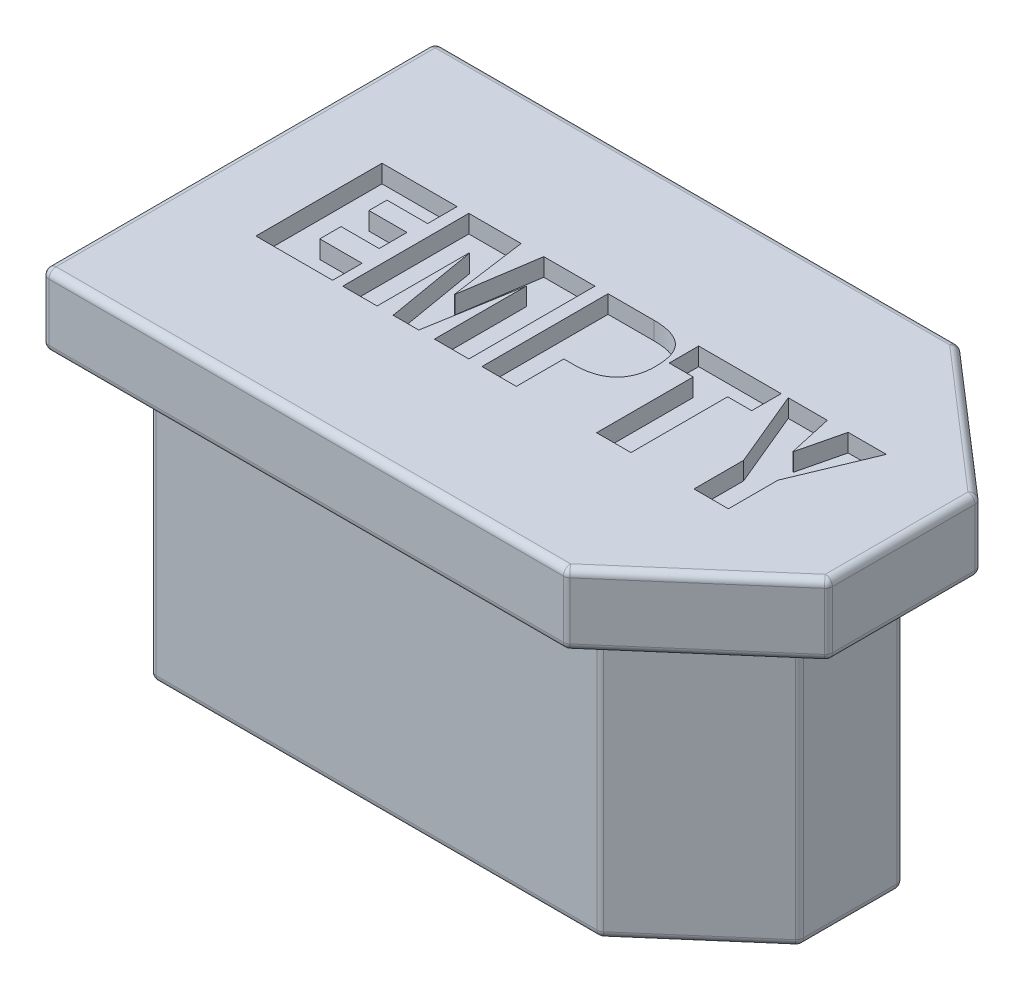
from build123d import *

# Parameters (mm, degrees)
BOSS_EXTRUDE1_DEPTH = 4
SHELL1_T            = -0.7
BOSS_EXTRUDE2_DEPTH = 2
BOSS_EXTRUDE4_REACH = 16.722
SKETCH4_W           = 2
SKETCH4_H           = 1.2
SKETCH5_W           = 1.1
SKETCH5_H           = 4
CUT_EXTRUDE1_DEPTH  = 1
FILLET1_R           = 0.2
CUT_EXTRUDE2_DEPTH  = 0.5


with BuildPart() as part:
    # Sketch1 → Boss-Extrude1 (new, symmetric)
    with BuildSketch(Plane(origin=(0, 0, 0), x_dir=(1, 0, 0), z_dir=(0, 1, 0))):
        Polygon((-7.800231879, 4), (4.799768121, 4), (7.800231879, 1.4), (7.800231879, -1.4), (4.799768121, -4), (-7.800231879, -4), align=None)
    extrude(amount=BOSS_EXTRUDE1_DEPTH, both=True)

    # Shell1
    shell1_openings = [part.faces().sort_by_distance(p)[0] for p in [
        (-0.453398861, 4, 0),
        (-0.453398861, -4, 0),
    ]]
    offset(amount=SHELL1_T, openings=shell1_openings, kind=Kind.INTERSECTION)

    # Sketch2 → Boss-Extrude2 (add)
    with BuildSketch(Plane(origin=(0, 4, 0), x_dir=(1, 0, 0), z_dir=(0, 1, 0))):
        Polygon((-9.300231879, 5.5), (-9.300231879, -5.5), (5.359252751, -5.5), (9.300231879, -2.085012665), (9.300231879, 2.085012665), (5.359252751, 5.5), align=None)
    extrude(amount=BOSS_EXTRUDE2_DEPTH)

    # Sketch4 → Boss-Extrude4 (add, up to next)
    with BuildSketch(Plane.XZ.offset(4), mode=Mode.PRIVATE) as boss_extrude4_sk1:
        with Locations((-0.100231879, -2.7)):
            Rectangle(SKETCH4_W, SKETCH4_H)
    boss_extrude4_tool1 = extrude(boss_extrude4_sk1.sketch, amount=-BOSS_EXTRUDE4_REACH, mode=Mode.PRIVATE) - part.part
    add(boss_extrude4_tool1.solids().sort_by_distance((-0.100232, -4, -2.7))[0])

    # Sketch5 → Cut-Extrude1 (cut)
    with BuildSketch(Plane.XZ.offset(-4)):
        with Locations((-0.100231879, -0.1)):
            Rectangle(SKETCH5_W, SKETCH5_H)
    extrude(amount=-CUT_EXTRUDE1_DEPTH, mode=Mode.SUBTRACT)

    # Fillet1
    fillet1_edges = [part.edges().sort_by_distance(p)[0] for p in [
        (6.3, 4, 2.7),
        (-7.800231879, 0, -4),
        (4.799768121, 0, -4),
        (7.800231879, 0, -1.4),
        (7.800231879, 0, 1.4),
        (4.799768121, 0, 4),
        (-7.800231879, 0, 4),
        (7.800231879, 4, 0),
        (6.3, 4, -2.7),
        (-1.500231879, 4, -4),
        (-7.100231879, -4, 0),
        (-7.100231879, 0, -3.3),
        (-1.280778293, -4, 3.3),
        (-7.100231879, 0, 3.3),
        (5.819453586, -4, 2.190163711),
        (4.538675293, 0, 3.3),
        (7.100231879, -4, 0),
        (7.100231879, 0, 1.080327423),
        (5.819453586, -4, -2.190163711),
        (7.100231879, 0, -1.080327423),
        (2.719221707, -4, -3.3),
        (4.538675293, 0, -3.3),
        (-7.100231879, 4, 0),
        (-1.280778293, 4, 3.3),
        (5.819453586, 4, 2.190163711),
        (7.100231879, 4, 0),
        (5.819453586, 4, -2.190163711),
        (2.719221707, 4, -3.3),
        (-1.970489564, 4, -5.5),
        (5.359252751, 5, -5.5),
        (-9.300231879, 4, 0),
        (-9.300231879, 5, -5.5),
        (-1.970489564, 4, 5.5),
        (-9.300231879, 5, 5.5),
        (7.329742315, 4, 3.792506333),
        (5.359252751, 5, 5.5),
        (9.300231879, 4, 0),
        (9.300231879, 5, 2.085012665),
        (7.329742315, 4, -3.792506333),
        (9.300231879, 5, -2.085012665),
        (-7.800231879, 4, 0),
        (-1.970489564, 6, -5.5),
        (-9.300231879, 6, 0),
        (-1.970489564, 6, 5.5),
        (7.329742315, 6, 3.792506333),
        (9.300231879, 6, 0),
        (7.329742315, 6, -3.792506333),
        (-4.100231879, 4, -3.3),
        (-1.500231879, -4, -4),
        (-4.100231879, -4, -3.3),
        (0.899768121, 0, -3.3),
        (-1.100231879, 4, -2.7),
        (-1.100231879, 0, -3.3),
        (0.674768121, 4, -2.1),
        (-1.100231879, 0, -2.1),
        (0.899768121, 4, -2.7),
        (0.899768121, 0, -2.1),
        (6.3, -4, -2.7),
        (0.899768121, -4, -2.7),
        (-0.100231879, -4, -2.1),
        (-1.100231879, -4, -2.7),
        (7.800231879, -4, 0),
        (-1.500231879, 4, 4),
        (6.3, -4, 2.7),
        (-0.875231879, 4, -2.1),
        (-1.500231879, -4, 4),
        (-0.100231879, 5, -2.1),
        (0.449768121, 4.5, -2.1),
        (-0.650231879, 5, -0.1),
        (-0.650231879, 4.5, -2.1),
        (-0.100231879, 5, 1.9),
        (-0.650231879, 4.5, 1.9),
        (0.449768121, 5, -0.1),
        (0.449768121, 4.5, 1.9),
        (0.449768121, 4, -0.1),
        (-0.100231879, 4, 1.9),
        (-0.650231879, 4, -0.1),
        (-7.800231879, -4, 0),
    ]]
    fillet(fillet1_edges, radius=FILLET1_R)

    # Sketch6 → Cut-Extrude2 (cut)
    with BuildSketch(Plane(origin=(0, 6, 0), x_dir=(1, 0, 0), z_dir=(0, 1, 0))):
        Polygon((-7.050360511, 1.763183333), (-4.950855682, 1.763183333), (-4.950855682, 0.938837879), (-6.088624148, 0.938837879), (-6.088624148, 0.435071212), (-5.025275758, 0.435071212), (-5.025275758, -0.343477273), (-6.088624148, -0.343477273), (-6.088624148, -0.938837879), (-4.906489867, -0.938837879), (-4.906489867, -1.763183333), (-7.050360511, -1.763183333), align=None)
        Polygon((-4.623121117, 1.763183333), (-3.161911553, 1.763183333), (-2.864946828, -0.389274242), (-2.854928741, -0.389274242), (-2.527194176, 1.763183333), (-1.096754451, 1.763183333), (-1.096754451, -1.763183333), (-2.058490814, -1.763183333), (-2.058490814, 0.808602746), (-2.496424337, -1.763183333), (-3.213433144, -1.763183333), (-3.651366667, 0.808602746), (-3.661384754, 0.808602746), (-3.661384754, -1.763183333), (-4.623121117, -1.763183333), align=None)
        with BuildLine():
            Line((-0.730378693, 1.763183333), (0.552652036, 1.763183333))
            add(Edge.make_bspline(
                [(0.552652036, 1.763183333), (0.641745263, 1.76229429), (0.771771867, 1.756812309), (0.937988563, 1.7296027), (1.049628527, 1.700819461), (1.153036234, 1.665454828), (1.247196621, 1.620791385), (1.332910955, 1.568640081), (1.40985321, 1.507890868), (1.477930038, 1.43798182), (1.536147356, 1.357461688), (1.585828883, 1.267090986), (1.626476651, 1.166434928), (1.657817768, 1.055566045), (1.687828585, 0.888418902), (1.69592351, 0.756866907), (1.695429545, 0.666202794)],
                knots=[0, 0, 0, 0, 0.146362964, 0.213050913, 0.276108881, 0.335424675, 0.392172577, 0.446835693, 0.499792168, 0.552680565, 0.606484305, 0.662389797, 0.721576216, 0.78428799, 0.851179087, 1, 1, 1, 1], degree=3))
            add(Edge.make_bspline(
                [(1.695429545, 0.666202794), (1.694306332, 0.574673008), (1.687218248, 0.441271543), (1.649503939, 0.273724158), (1.611879134, 0.163357502), (1.562857383, 0.064044652), (1.507670199, -0.027155961), (1.441481133, -0.107785991), (1.36767856, -0.179759564), (1.285683485, -0.241976571), (1.196711595, -0.295553107), (1.100375454, -0.339833244), (0.997225536, -0.375345936), (0.888265761, -0.402619817), (0.733370245, -0.426775799), (0.61430217, -0.436438725), (0.533331439, -0.435071212)],
                knots=[0, 0, 0, 0, 0.150663008, 0.218160378, 0.281611966, 0.341726761, 0.399797705, 0.456348045, 0.512604347, 0.568800563, 0.625051405, 0.682910411, 0.742644659, 0.804042171, 0.86717714, 1, 1, 1, 1], degree=3))
            Line((0.533331439, -0.435071212), (0.23135767, -0.435071212))
            Line((0.23135767, -0.435071212), (0.23135767, -1.763183333))
            Line((0.23135767, -1.763183333), (-0.730378693, -1.763183333))
            Line((-0.730378693, -1.763183333), (-0.730378693, 1.763183333))
        make_face()
        Polygon((1.802766193, 1.763183333), (4.109788542, 1.763183333), (4.109788542, 0.938837879), (3.437145549, 0.938837879), (3.437145549, -1.763183333), (2.475409186, -1.763183333), (2.475409186, 0.938837879), (1.802766193, 0.938837879), align=None)
        Polygon((5.982003078, 1.763183333), (7.050360511, 1.763183333), (6.160181913, -0.375678267), (6.160181913, -1.763183333), (5.198445549, -1.763183333), (5.198445549, -0.375678267), (4.308266951, 1.763183333), (5.400238447, 1.763183333), (5.674304687, 0.531674195), (5.684322775, 0.531674195), align=None)
    extrude(amount=-CUT_EXTRUDE2_DEPTH, mode=Mode.SUBTRACT)


solid = part.part
